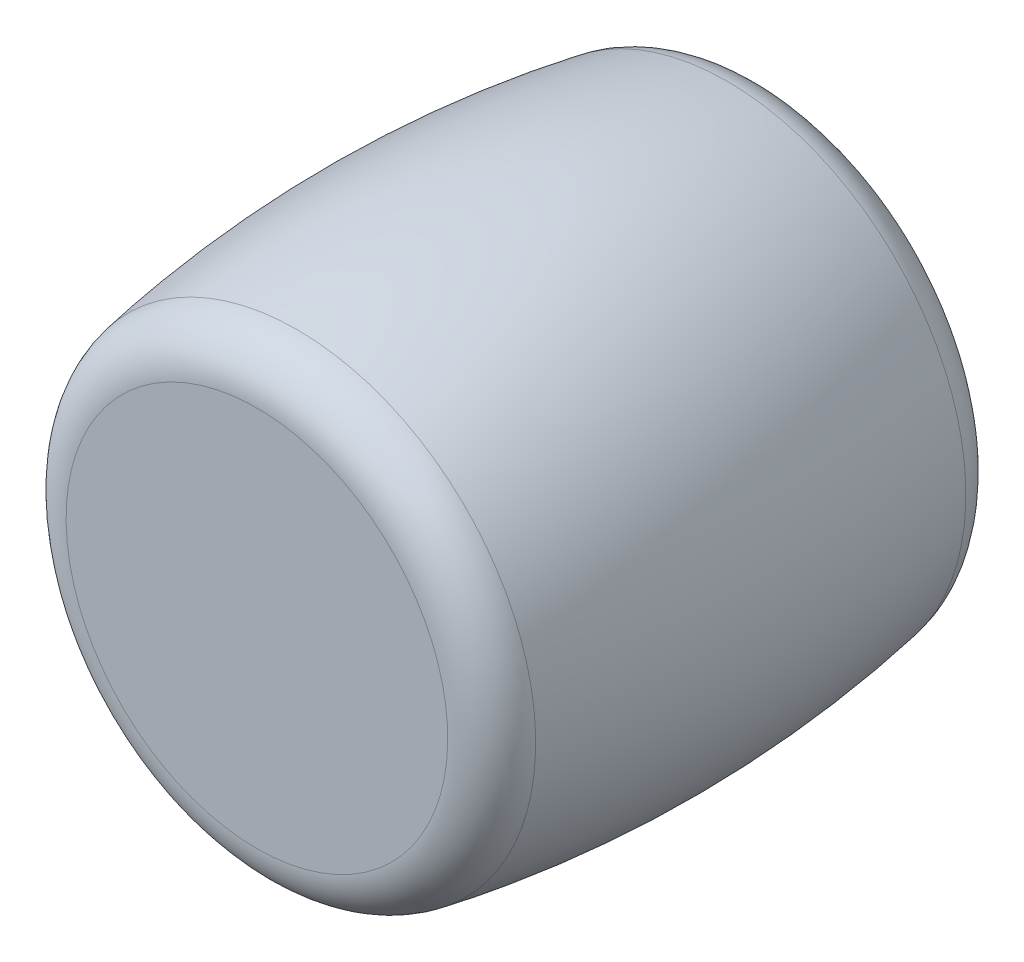
from build123d import *

# Parameters (mm, degrees)
SKETCH4_W    = 21
SKETCH4_H    = 9.5
FILLET1_R    = 2
SCALE1_SCALE = 0.5


with BuildPart() as part:
    # Sketch4 → Revolve1 (revolve)
    with BuildSketch(Plane(origin=(0, 0, 0), x_dir=(0, 0, -1), z_dir=(1, 0, 0))):
        with BuildLine():
            ThreePointArc((-10.5, 4.75), (0, 5.853643859), (10.5, 4.75))
            Line((10.5, 4.75), (-10.5, 4.75))
        make_face()
        Rectangle(SKETCH4_W, SKETCH4_H)
    revolve(axis=Axis((0, -4.75, -14.725718804), (0, 0, 1)))

    # Fillet1
    fillet1_edges = [part.edges().sort_by_distance(p)[0] for p in [
        (0, -14.25, -10.5),
        (0, -14.25, 10.5),
    ]]
    fillet(fillet1_edges, radius=FILLET1_R)


with BuildPart() as part_1:
    # Scale1: scaled about (0, 0, 0)
    add(part.part.scale(SCALE1_SCALE))


solid = part_1.part
